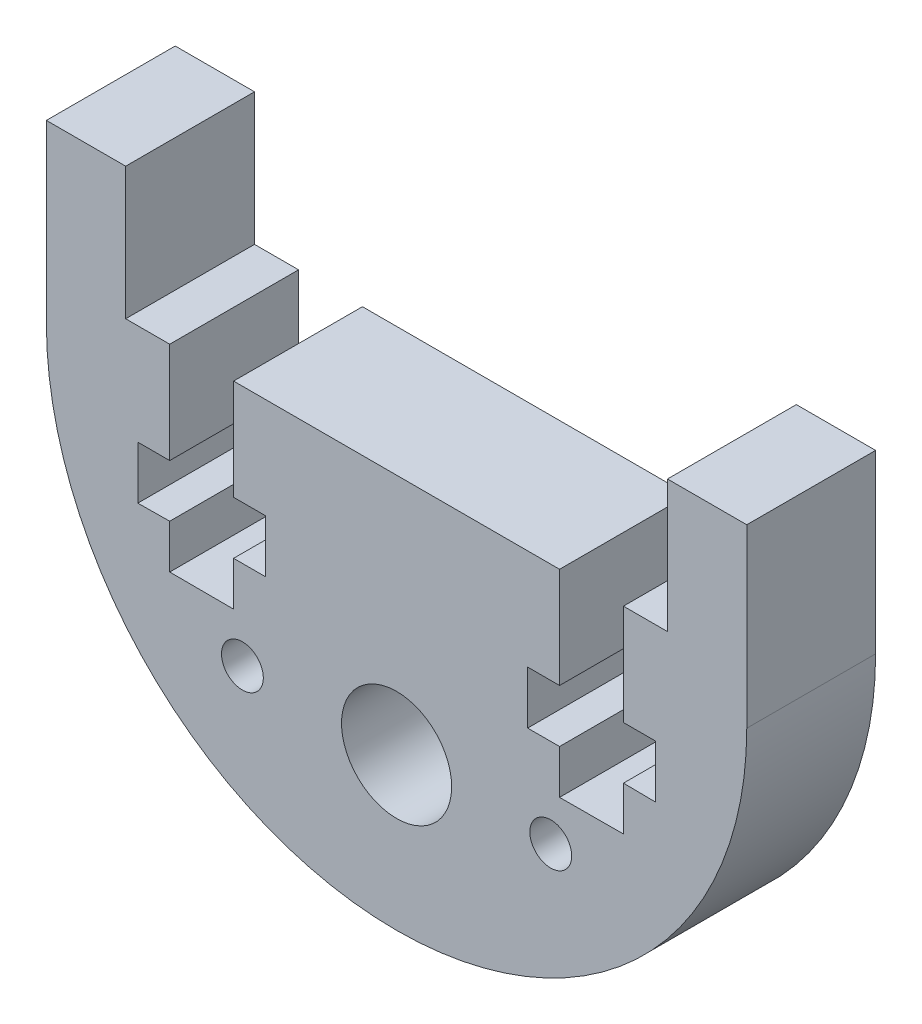
from build123d import *

# Parameters (mm, degrees)
MODEL_R             = 0.95
MODEL_R_2           = 2.49989274
BOSS_EXTRUDE2_DEPTH = 5.85


with BuildPart() as part:
    # Model → Boss-Extrude2 (new body)
    with BuildSketch(Plane.XY):
        with BuildLine():
            Line((553.509477136, 558.532469), (546.109477136, 558.532469))
            Line((546.109477136, 558.532469), (546.109477136, 553.961751207))
            Line((546.109477136, 553.961751207), (547.559476844, 553.962671766))
            Line((547.559476844, 553.962671766), (547.559476844, 551.562620711))
            Line((547.559476844, 551.562620711), (546.109477111, 551.563500787))
            Line((546.109477111, 551.563500787), (546.109477111, 549.563500787))
            Line((546.109477111, 549.563500787), (543.209383557, 549.573000091))
            Line((543.209383557, 549.573000091), (543.209383557, 551.573000091))
            Line((543.209383557, 551.573000091), (541.759477136, 551.556526783))
            Line((541.759477136, 551.556526783), (541.759477136, 553.956577839))
            Line((541.759477136, 553.956577839), (543.209477136, 553.956563))
            Line((543.209477136, 553.956563), (543.209477136, 558.532469))
            Line((543.209477136, 558.532469), (541.209477136, 558.532469))
            Line((541.209477136, 558.532469), (541.209477136, 564.532469))
            Line((541.209477136, 564.532469), (537.609477136, 564.532469))
            Line((537.609477136, 564.532469), (537.609477136, 556.532469))
            ThreePointArc((537.609477136, 556.532469), (553.509477136, 540.632469), (569.409477136, 556.532469))
            Line((569.409477136, 556.532469), (569.409477136, 564.532469))
            Line((569.409477136, 564.532469), (565.809477136, 564.532469))
            Line((565.809477136, 564.532469), (565.809477136, 558.532469))
            Line((565.809477136, 558.532469), (563.809477136, 558.532469))
            Line((563.809477136, 558.532469), (563.809477136, 553.956563))
            Line((563.809477136, 553.956563), (565.259477136, 553.956577839))
            Line((565.259477136, 553.956577839), (565.259477136, 551.556526783))
            Line((565.259477136, 551.556526783), (563.809570715, 551.573000091))
            Line((563.809570715, 551.573000091), (563.809570715, 549.573000091))
            Line((563.809570715, 549.573000091), (560.909477161, 549.563500787))
            Line((560.909477161, 549.563500787), (560.909477161, 551.563500787))
            Line((560.909477161, 551.563500787), (559.459477428, 551.562620711))
            Line((559.459477428, 551.562620711), (559.459477428, 553.962671766))
            Line((559.459477428, 553.962671766), (560.909477136, 553.961751207))
            Line((560.909477136, 553.961751207), (560.909477136, 558.532469))
            Line((560.909477136, 558.532469), (553.509477136, 558.532469))
        make_face()
        with Locations((546.509477136, 547.532469)):
            Circle(MODEL_R, mode=Mode.SUBTRACT)
        with Locations((553.509477136, 547.532469)):
            Circle(MODEL_R_2, mode=Mode.SUBTRACT)
        with Locations((560.509477136, 547.532469)):
            Circle(MODEL_R, mode=Mode.SUBTRACT)
    extrude(amount=BOSS_EXTRUDE2_DEPTH)


solid = part.part
